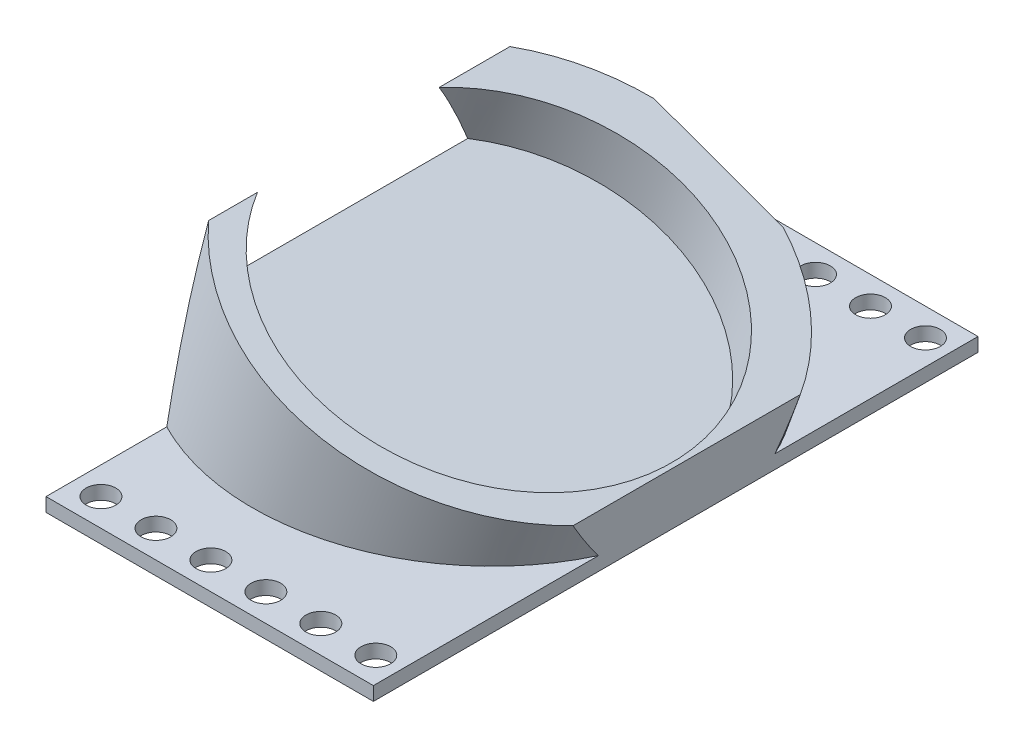
from build123d import *

# Parameters (mm, degrees)
SKETCH1_W                = 228.6
SKETCH1_H                = 127
BOSS_EXTRUDE1_DEPTH      = 50.8
CUT_EXTRUDE24_DEPTH      = 196.514014843
CUT_EXTRUDE24_DEPTH_BACK = 196.514014843
SKETCH30_W               = 94.400264643
SKETCH30_H               = 127
SKETCH30_W_2             = 58.559389051
SKETCH31_W               = 75.640346306
SKETCH31_H               = 101.6
CUT_EXTRUDE25_DEPTH      = 68.58
CUT_EXTRUDE26_DEPTH      = 73.726300143
CUT_EXTRUDE26_DEPTH_BACK = 73.726300143
SKETCH32_OUTSIDE_W       = 113.175
SKETCH32_OUTSIDE_H       = 130.144
SKETCH32_OUTSIDE_R       = 50.8
SKETCH34_W               = 90.599470714
SKETCH34_H               = 139.7
SKETCH34_R               = 3.429
BOSS_EXTRUDE2_DEPTH      = 3.175
CUT_EXTRUDE28_DEPTH      = 91.882042278
CUT_EXTRUDE28_DEPTH_BACK = 91.882042278


with BuildPart() as part:
    # Sketch1 → Boss-Extrude1 (new, symmetric)
    with BuildSketch(Plane.XY):
        with Locations((-25.4, -63.5)):
            Rectangle(SKETCH1_W, SKETCH1_H)
    extrude(amount=BOSS_EXTRUDE1_DEPTH, both=True)

    # Sketch2 → Cut-Revolve1 (revolve, cut)
    with BuildSketch(Plane.XY, mode=Mode.PRIVATE) as cut_revolve1_sk:
        Polygon((-50.503182361, -16.903094944), (-105.996730082, 3.29490462), (-55.183426739, 142.903308162), (40.289343532, 108.1540616), (0, -2.54), (-14.86761563, -43.388438226), (-54.846838182, -28.837191228), align=None)
    revolve(cut_revolve1_sk.sketch.rotate(Axis((-60.4239625, -168.553472561, 0), (0.3420201433256656, 0.9396926207859095, 0)), 180), axis=Axis((-60.4239625, -168.553472561, 0), (0.3420201433256656, 0.9396926207859095, 0)), mode=Mode.SUBTRACT)

    # Sketch30 → Cut-Extrude24 (cut, two sides: drawn at the far end of the back side and taken through both)
    with BuildSketch(Plane.XY.offset(-CUT_EXTRUDE24_DEPTH_BACK)):
        with Locations((-92.499867679, -63.5)):
            Rectangle(SKETCH30_W, SKETCH30_H)
        with Locations((59.620305475, -63.5)):
            Rectangle(SKETCH30_W_2, SKETCH30_H)
    extrude(amount=CUT_EXTRUDE24_DEPTH + CUT_EXTRUDE24_DEPTH_BACK, mode=Mode.SUBTRACT)

    # Sketch31 → Cut-Extrude25 (cut)
    with BuildSketch(Plane.XZ.offset(127)):
        with Locations((-7.479562204, 0)):
            Rectangle(SKETCH31_W, SKETCH31_H)
    extrude(amount=-CUT_EXTRUDE25_DEPTH, mode=Mode.SUBTRACT)

    # Sketch32 outside → Cut-Extrude26 (cut, two sides: drawn at the far end of the back side and taken through both)
    with BuildSketch(Plane(origin=(-15.683955895, -43.091314668, 0), x_dir=(0.9396926207859096, -0.3420201433256657, 0), z_dir=(0.3420201433256657, 0.9396926207859096, 0)).offset(-CUT_EXTRUDE26_DEPTH_BACK)):
        with Locations((6.1765, 0)):
            Rectangle(SKETCH32_OUTSIDE_W, SKETCH32_OUTSIDE_H)
        with Locations((0.868731164, 2.54)):
            Circle(SKETCH32_OUTSIDE_R, mode=Mode.SUBTRACT)
    extrude(amount=CUT_EXTRUDE26_DEPTH + CUT_EXTRUDE26_DEPTH_BACK, mode=Mode.SUBTRACT)

    # Sketch34 → Boss-Extrude2 (add)
    with BuildSketch(Plane.XZ.offset(58.42)):
        Rectangle(SKETCH34_W, SKETCH34_H)
        with Locations(Location((-38.949735357, 63.5, 0), (0, 0, 270))):
            Circle(SKETCH34_R, mode=Mode.SUBTRACT)
        with Locations(Location((-26.249735357, 63.5, 0), (0, 0, 270))):
            Circle(SKETCH34_R, mode=Mode.SUBTRACT)
        with Locations(Location((-13.549735357, 63.5, 0), (0, 0, 270))):
            Circle(SKETCH34_R, mode=Mode.SUBTRACT)
        with Locations(Location((-0.849735357, 63.5, 0), (0, 0, 270))):
            Circle(SKETCH34_R, mode=Mode.SUBTRACT)
        with Locations(Location((11.850264643, 63.5, 0), (0, 0, 270))):
            Circle(SKETCH34_R, mode=Mode.SUBTRACT)
        with Locations(Location((24.550264643, 63.5, 0), (0, 0, 270))):
            Circle(SKETCH34_R, mode=Mode.SUBTRACT)
        with Locations(Location((-26.249735357, -63.5, 0), (0, 0, 270))):
            Circle(SKETCH34_R, mode=Mode.SUBTRACT)
        with Locations(Location((-13.549735357, -63.5, 0), (0, 0, 270))):
            Circle(SKETCH34_R, mode=Mode.SUBTRACT)
        with Locations(Location((-0.849735357, -63.5, 0), (0, 0, 270))):
            Circle(SKETCH34_R, mode=Mode.SUBTRACT)
        with Locations(Location((11.850264643, -63.5, 0), (0, 0, 270))):
            Circle(SKETCH34_R, mode=Mode.SUBTRACT)
        with Locations(Location((24.550264643, -63.5, 0), (0, 0, 270))):
            Circle(SKETCH34_R, mode=Mode.SUBTRACT)
        with Locations(Location((-38.949735357, -63.5, 0), (0, 0, 270))):
            Circle(SKETCH34_R, mode=Mode.SUBTRACT)
        Polygon((8.18326415, 23.631227188), (17.570519416, 30.368097404), (24.550264643, 23.631227188), (27.611749682, 8.577894095), (26.081007163, -20.911612947), (15.410103284, -35.988916053), (9.99990449, -28.4502645), align=None, mode=Mode.SUBTRACT)
    extrude(amount=-BOSS_EXTRUDE2_DEPTH)

    # Sketch35 → Cut-Extrude28 (cut, two sides: drawn at the far end of the back side and taken through both)
    with BuildSketch(Plane(origin=(0, -55.245, 0), x_dir=(1, 0, 0), z_dir=(0, 1, 0)).offset(-CUT_EXTRUDE28_DEPTH_BACK)):
        Polygon((30.340610949, 28.79845063), (30.340610949, 69.85), (45.299735357, 69.85), (45.299735357, -69.85), (30.340610949, -69.85), align=None)
    extrude(amount=CUT_EXTRUDE28_DEPTH + CUT_EXTRUDE28_DEPTH_BACK, mode=Mode.SUBTRACT)


solid = part.part
